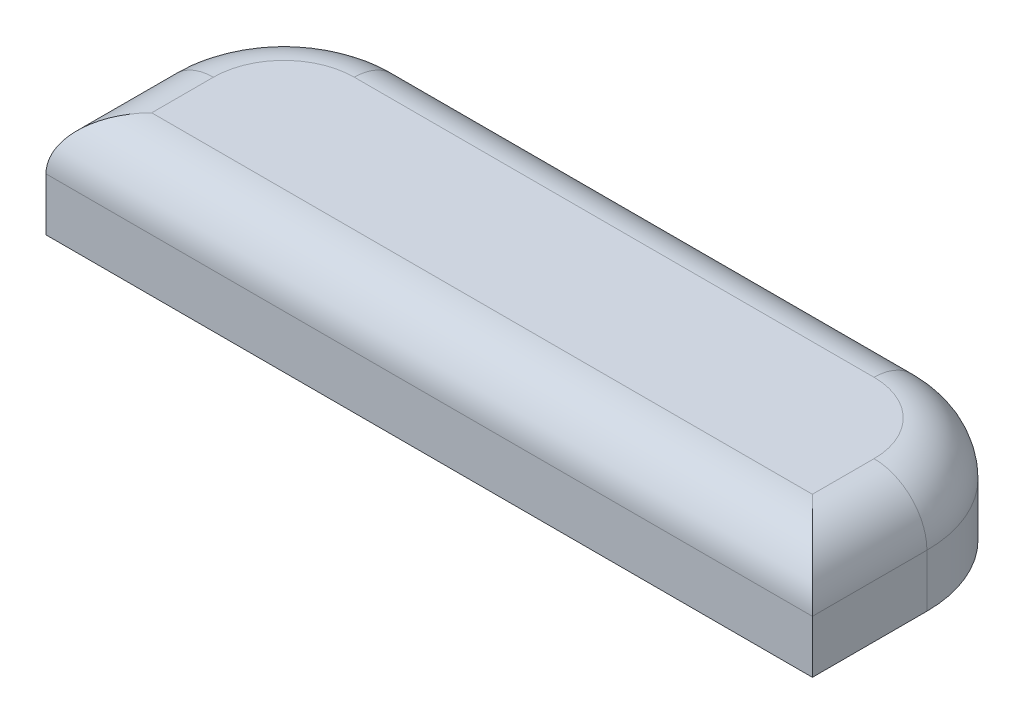
from build123d import *

# Parameters (mm, degrees)
BOSS_EXTRUDE1_DEPTH = 12
FILLET2_R           = 6


with BuildPart() as part:
    # Sketch1 → Boss-Extrude1 (new body)
    with BuildSketch(Plane(origin=(0, -295.781515915, 0), x_dir=(1, 0, 0), z_dir=(0, 1, 0))):
        with BuildLine():
            Line((469.577970857, -27), (469.577970857, -14))
            ThreePointArc((469.577970857, -14), (465.477465793, -4.100505063), (455.577970857, 0))
            Line((455.577970857, 0), (396.577970857, 0))
            ThreePointArc((396.577970857, 0), (386.67847592, -4.100505063), (382.577970857, -14))
            Line((382.577970857, -14), (382.577970857, -27))
            Line((382.577970857, -27), (469.577970857, -27))
        make_face()
    extrude(amount=BOSS_EXTRUDE1_DEPTH)

    # Fillet2
    fillet2_edges = [part.edges().sort_by_distance(p)[0] for p in [
        (465.477465793, -283.781515915, 4.100505063),
        (426.077970857, -283.781515915, 0),
        (386.67847592, -283.781515915, 4.100505063),
        (382.577970857, -283.781515915, 20.5),
        (426.077970857, -283.781515915, 27),
        (469.577970857, -283.781515915, 20.5),
    ]]
    fillet(fillet2_edges, radius=FILLET2_R)


solid = part.part
